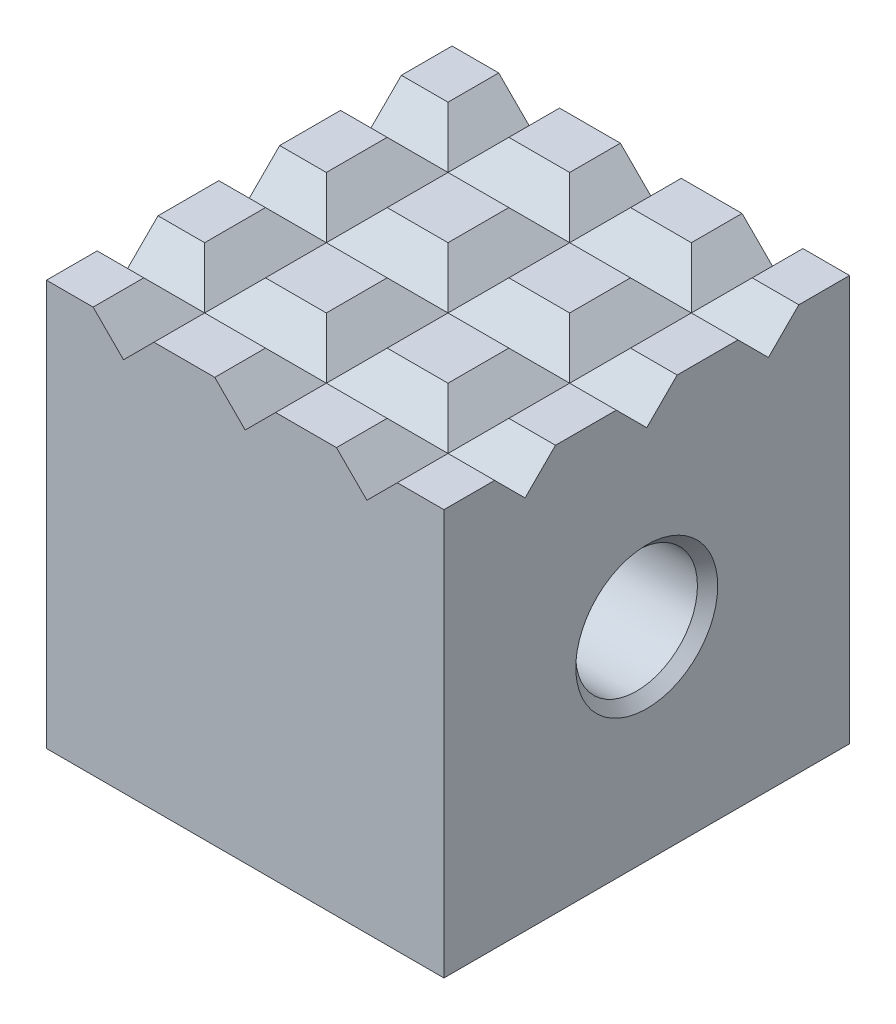
from build123d import *

# Parameters (mm, degrees)
SKETCH1_R               = 3
BOSS_EXTRUDE1_DEPTH     = 9.8
CUT_EXTRUDE1_DEPTH      = 18.205812971
CUT_EXTRUDE1_DEPTH_BACK = 18.205812971
CHAMFER1_SIZE           = 0.5


with BuildPart() as part:
    # Sketch1 → Boss-Extrude1 (new, symmetric)
    with BuildSketch(Plane(origin=(0, 0, 0), x_dir=(0, 0, -1), z_dir=(1, 0, 0))):
        Polygon((-10, 10), (-10, -10), (10, -10), (10, 10), (7.5, 10), (6, 8.5), (4.5, 10), (1.5, 10), (0, 8.5), (-1.5, 10), (-4.5, 10), (-6, 8.5), (-7.5, 10), align=None)
        Circle(SKETCH1_R, mode=Mode.SUBTRACT)
    extrude(amount=BOSS_EXTRUDE1_DEPTH, both=True)

    # Sketch2 → Cut-Extrude1 (cut, two sides: drawn at the far end of the back side and taken through both)
    with BuildSketch(Plane.XY.offset(-CUT_EXTRUDE1_DEPTH_BACK)):
        Polygon((-7.5, 10), (-4.5, 10), (-6, 8.5), align=None)
        Polygon((0, 8.5), (-1.5, 10), (1.5, 10), align=None)
        Polygon((4.5, 10), (6, 8.5), (7.5, 10), align=None)
    extrude(amount=CUT_EXTRUDE1_DEPTH + CUT_EXTRUDE1_DEPTH_BACK, mode=Mode.SUBTRACT)

    # Chamfer1
    chamfer1_edges = [part.edges().sort_by_distance(p)[0] for p in [
        (-9.8, 0, 3),
        (9.8, 0, 3),
    ]]
    chamfer(chamfer1_edges, length=CHAMFER1_SIZE)


solid = part.part
